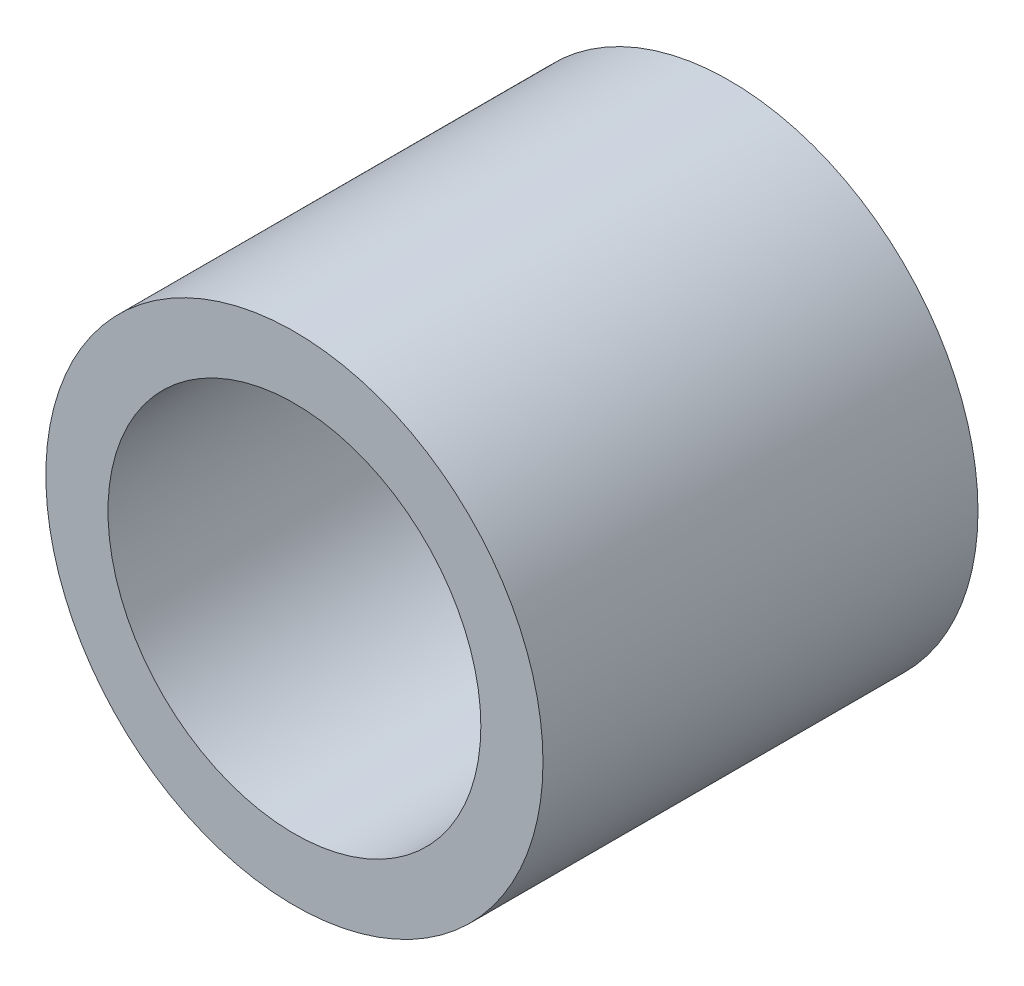
from build123d import *

# Parameters (mm, degrees)
SKETCH1_R           = 20
SKETCH1_R_2         = 15
BOSS_EXTRUDE1_DEPTH = 17.5


with BuildPart() as part:
    # Sketch1 → Boss-Extrude1 (new, symmetric)
    with BuildSketch(Plane.XY):
        Circle(SKETCH1_R)
        Circle(SKETCH1_R_2, mode=Mode.SUBTRACT)
    extrude(amount=BOSS_EXTRUDE1_DEPTH, both=True)


solid = part.part
